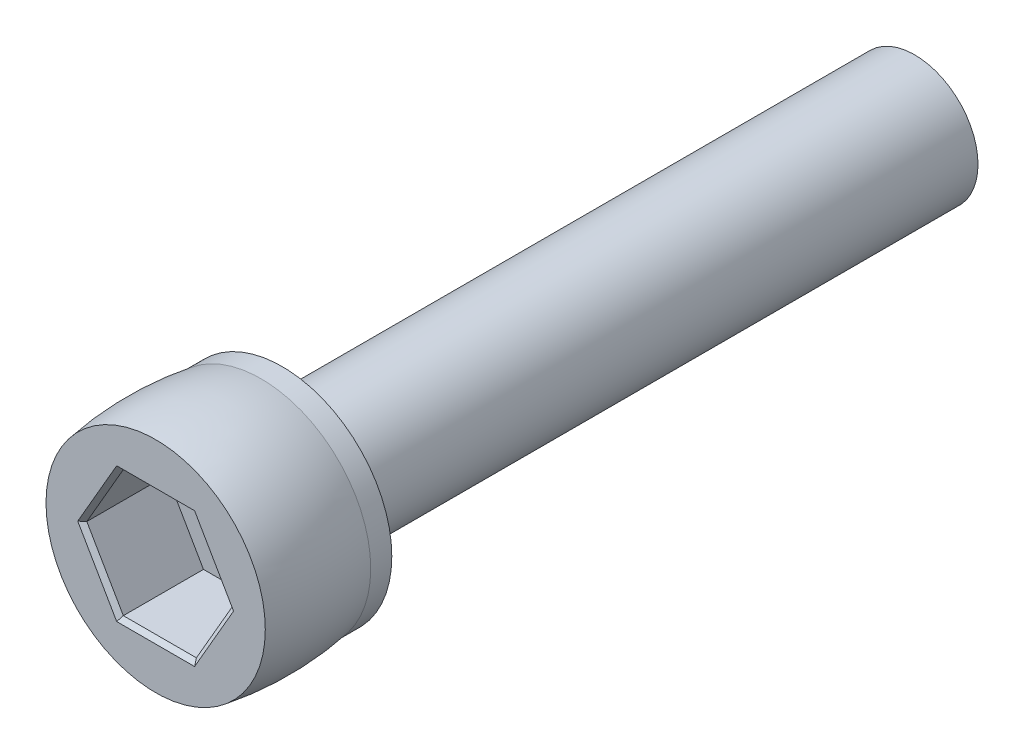
from build123d import *

# Parameters (mm, degrees)
SKETCH1_R           = 1.5
BOSS_EXTRUDE1_DEPTH = 15
SKETCH2_R           = 2.75
BOSS_EXTRUDE2_DEPTH = 3
CUT_EXTRUDE1_DEPTH  = 2
CHAMFER1_SIZE       = 0.1


with BuildPart() as part:
    # Sketch1 → Boss-Extrude1 (new body)
    with BuildSketch(Plane.XY):
        Circle(SKETCH1_R)
    extrude(amount=-BOSS_EXTRUDE1_DEPTH)

    # Sketch2 → Boss-Extrude2 (add)
    with BuildSketch(Plane.XY):
        Circle(SKETCH2_R)
    extrude(amount=BOSS_EXTRUDE2_DEPTH)

    # Sketch3 → Cut-Revolve1 (revolve, cut)
    with BuildSketch(Plane(origin=(0, 0, 0), x_dir=(0, 0, -1), z_dir=(1, 0, 0)), mode=Mode.PRIVATE) as cut_revolve1_sk:
        with BuildLine():
            Line((-3, 2.6), (-3, 3.1))
            Line((-3, 3.1), (0, 3.1))
            Line((0, 3.1), (0, 2.6))
            Line((0, 2.6), (-0.5, 2.6))
            ThreePointArc((-0.5, 2.6), (-1.75, 2.7), (-3, 2.6))
        make_face()
    revolve(cut_revolve1_sk.sketch.rotate(Axis((0, 0, 3), (0, 0, 1)), 90), axis=Axis((0, 0, 3), (0, 0, 1)), mode=Mode.SUBTRACT)

    # Sketch4 → Cut-Extrude1 (cut)
    with BuildSketch(Plane.XY.offset(3)):
        Polygon((1.732050808, 0), (0.866025404, 1.5), (-0.866025404, 1.5), (-1.732050808, 0), (-0.866025404, -1.5), (0.866025404, -1.5), align=None)
    extrude(amount=-CUT_EXTRUDE1_DEPTH, mode=Mode.SUBTRACT)

    # Chamfer1
    chamfer1_edges = [part.edges().sort_by_distance(p)[0] for p in [
        (1.299038106, -0.75, 3),
        (1.299038106, 0.75, 3),
        (0, 1.5, 3),
        (-1.299038106, 0.75, 3),
        (-1.299038106, -0.75, 3),
        (0, -1.5, 3),
    ]]
    chamfer(chamfer1_edges, length=CHAMFER1_SIZE)


solid = part.part
